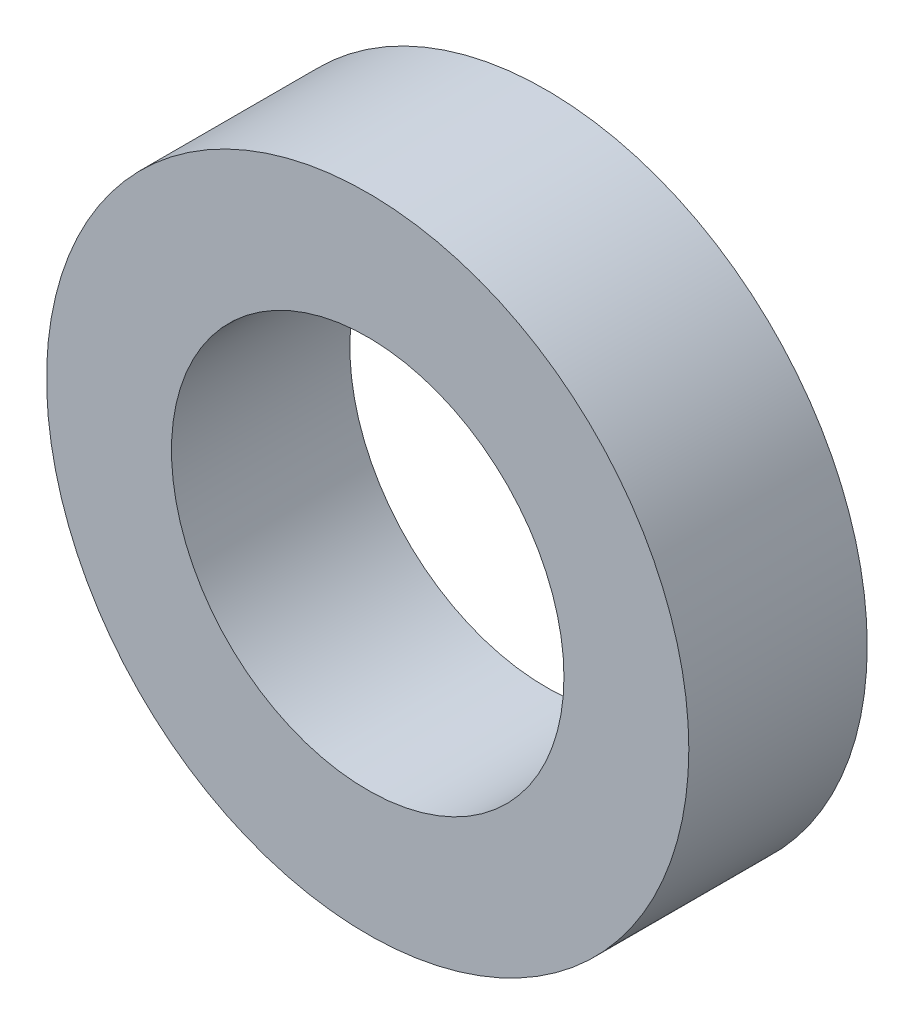
from build123d import *

# Parameters (mm, degrees)
SKETCH_1_R      = 45
SKETCH_1_R_2    = 27.5
EXTRUDE_1_DEPTH = 25


with BuildPart() as part:
    # 草图1 → 凸台-拉伸1 (new body)
    with BuildSketch(Plane.XY):
        Circle(SKETCH_1_R)
        Circle(SKETCH_1_R_2, mode=Mode.SUBTRACT)
    extrude(amount=EXTRUDE_1_DEPTH)


solid = part.part
